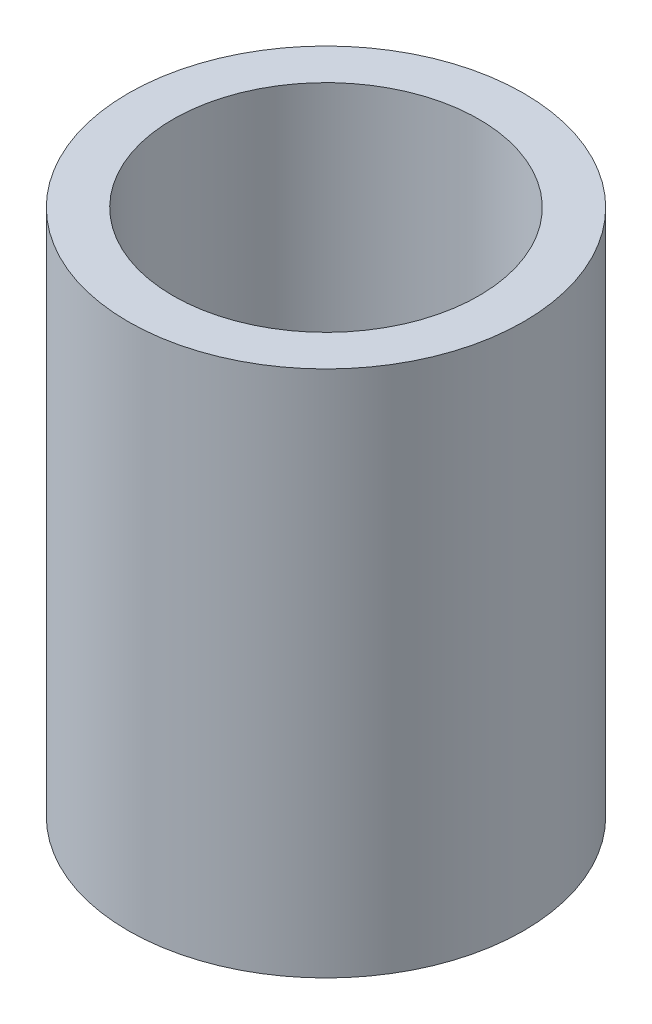
from build123d import *

# Parameters (mm, degrees)
SKETCH1_R             = 1.905
BOSS_EXTRUDE1_DEPTH   = 5.08
F_4_CLEARANCE_HOLE1_D = 2.9464


with BuildPart() as part:
    # Sketch1 → Boss-Extrude1 (new body)
    with BuildSketch(Plane(origin=(0, 0, 0), x_dir=(1, 0, 0), z_dir=(0, 1, 0))):
        with Locations(Location((0, 0, 0), (0, 0, 270))):
            Circle(SKETCH1_R)
    extrude(amount=BOSS_EXTRUDE1_DEPTH)

    # #4 Clearance Hole1 (through all)
    with Locations(Plane(origin=(0, 5.08, 0), x_dir=(1, 0, 0), z_dir=(0, 1, 0))):
        with Locations((0, 0)):
            Hole(F_4_CLEARANCE_HOLE1_D / 2)


solid = part.part
